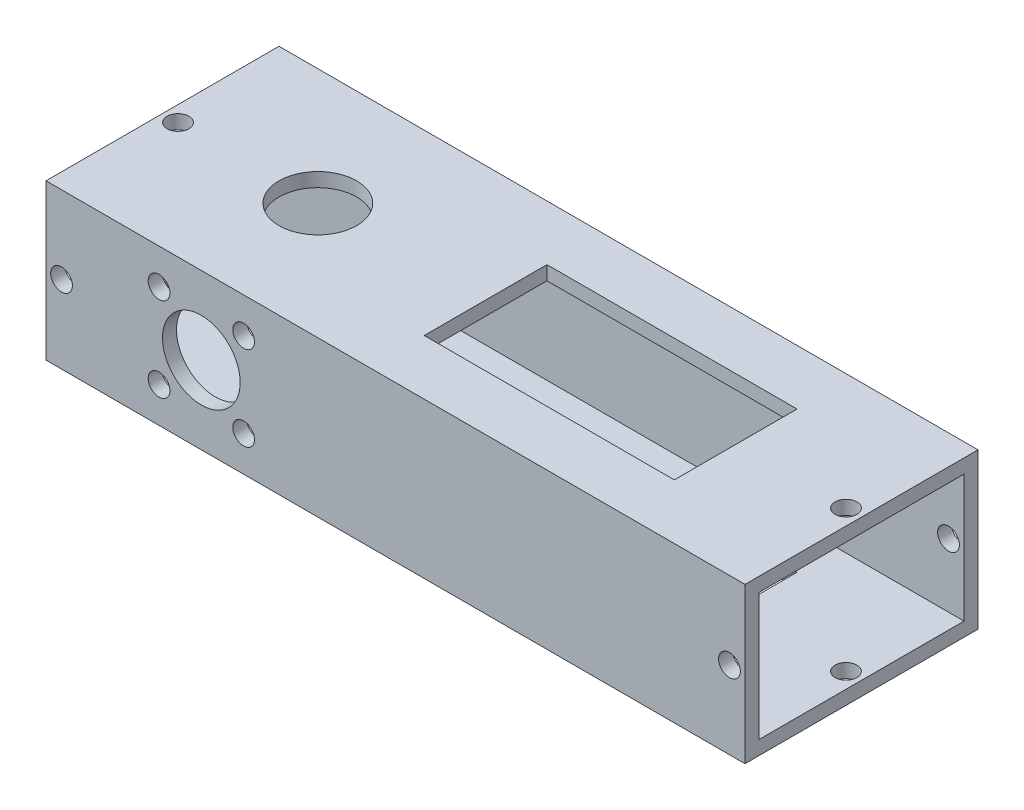
from build123d import *

# Parameters (mm, degrees)
SKETCH1_W           = 114.3
SKETCH1_H           = 38.1
BOSS_EXTRUDE1_DEPTH = 25.4
CUT_EXTRUDE1_REACH  = 125.131
SKETCH2_W           = 33.528
SKETCH2_H           = 20.828
CUT_EXTRUDE2_REACH  = 125.131
SKETCH3_R           = 1.778
CUT_EXTRUDE3_REACH  = 125.131
SKETCH4_R           = 1.778
CUT_EXTRUDE4_REACH  = 125.131
SKETCH5_R           = 1.778
SKETCH5_R_2         = 6.35
CUT_EXTRUDE5_REACH  = 125.131
SKETCH6_R           = 1.778
SKETCH6_R_2         = 6.35
CUT_EXTRUDE6_REACH  = 125.131
SKETCH7_R           = 1.778
SKETCH7_R_2         = 6.35
CUT_EXTRUDE7_REACH  = 125.131
SKETCH8_R           = 1.778
SKETCH8_R_2         = 6.35
CUT_EXTRUDE8_REACH  = 125.131
SKETCH9_R           = 1.778
CUT_EXTRUDE9_REACH  = 125.131
SKETCH10_R          = 1.778


with BuildPart() as part:
    # Sketch1 → Boss-Extrude1 (new body)
    with BuildSketch(Plane(origin=(0, 0, 0), x_dir=(1, 0, 0), z_dir=(0, 1, 0))):
        with Locations((-57.15, -19.05)):
            Rectangle(SKETCH1_W, SKETCH1_H)
    extrude(amount=BOSS_EXTRUDE1_DEPTH)

    # Sketch2 → Cut-Extrude1 (cut, up to next)
    with BuildSketch(Plane(origin=(0, 0, 0), x_dir=(0, 0, -1), z_dir=(1, 0, 0)), mode=Mode.PRIVATE) as cut_extrude1_sk1:
        with Locations((-19.05, 12.7)):
            Rectangle(SKETCH2_W, SKETCH2_H)
    cut_extrude1_tool1 = extrude(cut_extrude1_sk1.sketch, amount=-CUT_EXTRUDE1_REACH, mode=Mode.PRIVATE) & part.part
    add(cut_extrude1_tool1.solids().sort_by_distance((0, 12.7, 19.05))[0], mode=Mode.SUBTRACT)

    # Sketch3 → Cut-Extrude2 (cut, up to next)
    with BuildSketch(Plane.XY.offset(38.1), mode=Mode.PRIVATE) as cut_extrude2_sk1:
        with Locations((-2.54, 12.7)):
            Circle(SKETCH3_R)
    cut_extrude2_tool1 = extrude(cut_extrude2_sk1.sketch, amount=-CUT_EXTRUDE2_REACH, mode=Mode.PRIVATE) & part.part
    add(cut_extrude2_tool1.solids().sort_by_distance((-2.54, 12.7, 38.1))[0], mode=Mode.SUBTRACT)

    # Sketch4 → Cut-Extrude3 (cut, up to next)
    with BuildSketch(Plane(origin=(0, 0, 0), x_dir=(-1, 0, 0), z_dir=(0, 0, -1)), mode=Mode.PRIVATE) as cut_extrude3_sk1:
        with Locations(Location((2.54, 12.7, 0), (0, 0, 180))):
            Circle(SKETCH4_R)
    cut_extrude3_tool1 = extrude(cut_extrude3_sk1.sketch, amount=-CUT_EXTRUDE3_REACH, mode=Mode.PRIVATE) & part.part
    add(cut_extrude3_tool1.solids().sort_by_distance((-2.54, 12.7, 0))[0], mode=Mode.SUBTRACT)

    # Sketch5 → Cut-Extrude4 (cut, up to next)
    with BuildSketch(Plane.XY.offset(38.1), mode=Mode.PRIVATE) as cut_extrude4_sk1:
        with Locations((-111.76, 12.7)):
            Circle(SKETCH5_R)
    cut_extrude4_tool1 = extrude(cut_extrude4_sk1.sketch, amount=-CUT_EXTRUDE4_REACH, mode=Mode.PRIVATE) & part.part
    # Sketch5 → Cut-Extrude4 (cut, up to next)
    with BuildSketch(Plane.XY.offset(38.1), mode=Mode.PRIVATE) as cut_extrude4_sk2:
        with Locations((-88.9, 12.7)):
            Circle(SKETCH5_R_2)
    cut_extrude4_tool2 = extrude(cut_extrude4_sk2.sketch, amount=-CUT_EXTRUDE4_REACH, mode=Mode.PRIVATE) & part.part
    # Sketch5 → Cut-Extrude4 (cut, up to next)
    with BuildSketch(Plane.XY.offset(38.1), mode=Mode.PRIVATE) as cut_extrude4_sk3:
        with Locations((-95.814797213, 19.614797213)):
            Circle(SKETCH5_R)
    cut_extrude4_tool3 = extrude(cut_extrude4_sk3.sketch, amount=-CUT_EXTRUDE4_REACH, mode=Mode.PRIVATE) & part.part
    # Sketch5 → Cut-Extrude4 (cut, up to next)
    with BuildSketch(Plane.XY.offset(38.1), mode=Mode.PRIVATE) as cut_extrude4_sk4:
        with Locations((-81.985202787, 19.614797213)):
            Circle(SKETCH5_R)
    cut_extrude4_tool4 = extrude(cut_extrude4_sk4.sketch, amount=-CUT_EXTRUDE4_REACH, mode=Mode.PRIVATE) & part.part
    # Sketch5 → Cut-Extrude4 (cut, up to next)
    with BuildSketch(Plane.XY.offset(38.1), mode=Mode.PRIVATE) as cut_extrude4_sk5:
        with Locations((-95.814797213, 5.785202787)):
            Circle(SKETCH5_R)
    cut_extrude4_tool5 = extrude(cut_extrude4_sk5.sketch, amount=-CUT_EXTRUDE4_REACH, mode=Mode.PRIVATE) & part.part
    # Sketch5 → Cut-Extrude4 (cut, up to next)
    with BuildSketch(Plane.XY.offset(38.1), mode=Mode.PRIVATE) as cut_extrude4_sk6:
        with Locations((-81.985202787, 5.785202787)):
            Circle(SKETCH5_R)
    cut_extrude4_tool6 = extrude(cut_extrude4_sk6.sketch, amount=-CUT_EXTRUDE4_REACH, mode=Mode.PRIVATE) & part.part
    add(cut_extrude4_tool1.solids().sort_by_distance((-111.76, 12.7, 38.1))[0], mode=Mode.SUBTRACT)
    add(cut_extrude4_tool2.solids().sort_by_distance((-88.9, 12.7, 38.1))[0], mode=Mode.SUBTRACT)
    add(cut_extrude4_tool3.solids().sort_by_distance((-95.814797, 19.614797, 38.1))[0], mode=Mode.SUBTRACT)
    add(cut_extrude4_tool4.solids().sort_by_distance((-81.985203, 19.614797, 38.1))[0], mode=Mode.SUBTRACT)
    add(cut_extrude4_tool5.solids().sort_by_distance((-95.814797, 5.785203, 38.1))[0], mode=Mode.SUBTRACT)
    add(cut_extrude4_tool6.solids().sort_by_distance((-81.985203, 5.785203, 38.1))[0], mode=Mode.SUBTRACT)

    # Sketch6 → Cut-Extrude5 (cut, up to next)
    with BuildSketch(Plane(origin=(0, 0, 0), x_dir=(-1, 0, 0), z_dir=(0, 0, -1)), mode=Mode.PRIVATE) as cut_extrude5_sk1:
        with Locations(Location((111.76, 12.7, 0), (0, 0, 180))):
            Circle(SKETCH6_R)
    cut_extrude5_tool1 = extrude(cut_extrude5_sk1.sketch, amount=-CUT_EXTRUDE5_REACH, mode=Mode.PRIVATE) & part.part
    # Sketch6 → Cut-Extrude5 (cut, up to next)
    with BuildSketch(Plane(origin=(0, 0, 0), x_dir=(-1, 0, 0), z_dir=(0, 0, -1)), mode=Mode.PRIVATE) as cut_extrude5_sk2:
        with Locations(Location((88.9, 12.7, 0), (0, 0, 180))):
            Circle(SKETCH6_R_2)
    cut_extrude5_tool2 = extrude(cut_extrude5_sk2.sketch, amount=-CUT_EXTRUDE5_REACH, mode=Mode.PRIVATE) & part.part
    # Sketch6 → Cut-Extrude5 (cut, up to next)
    with BuildSketch(Plane(origin=(0, 0, 0), x_dir=(-1, 0, 0), z_dir=(0, 0, -1)), mode=Mode.PRIVATE) as cut_extrude5_sk3:
        with Locations(Location((81.985202787, 19.614797213, 0), (0, 0, 180))):
            Circle(SKETCH6_R)
    cut_extrude5_tool3 = extrude(cut_extrude5_sk3.sketch, amount=-CUT_EXTRUDE5_REACH, mode=Mode.PRIVATE) & part.part
    # Sketch6 → Cut-Extrude5 (cut, up to next)
    with BuildSketch(Plane(origin=(0, 0, 0), x_dir=(-1, 0, 0), z_dir=(0, 0, -1)), mode=Mode.PRIVATE) as cut_extrude5_sk4:
        with Locations(Location((95.814797213, 19.614797213, 0), (0, 0, 180))):
            Circle(SKETCH6_R)
    cut_extrude5_tool4 = extrude(cut_extrude5_sk4.sketch, amount=-CUT_EXTRUDE5_REACH, mode=Mode.PRIVATE) & part.part
    # Sketch6 → Cut-Extrude5 (cut, up to next)
    with BuildSketch(Plane(origin=(0, 0, 0), x_dir=(-1, 0, 0), z_dir=(0, 0, -1)), mode=Mode.PRIVATE) as cut_extrude5_sk5:
        with Locations(Location((95.814797213, 5.785202787, 0), (0, 0, 180))):
            Circle(SKETCH6_R)
    cut_extrude5_tool5 = extrude(cut_extrude5_sk5.sketch, amount=-CUT_EXTRUDE5_REACH, mode=Mode.PRIVATE) & part.part
    # Sketch6 → Cut-Extrude5 (cut, up to next)
    with BuildSketch(Plane(origin=(0, 0, 0), x_dir=(-1, 0, 0), z_dir=(0, 0, -1)), mode=Mode.PRIVATE) as cut_extrude5_sk6:
        with Locations(Location((81.985202787, 5.785202787, 0), (0, 0, 180))):
            Circle(SKETCH6_R)
    cut_extrude5_tool6 = extrude(cut_extrude5_sk6.sketch, amount=-CUT_EXTRUDE5_REACH, mode=Mode.PRIVATE) & part.part
    add(cut_extrude5_tool1.solids().sort_by_distance((-111.76, 12.7, 0))[0], mode=Mode.SUBTRACT)
    add(cut_extrude5_tool2.solids().sort_by_distance((-88.9, 12.7, 0))[0], mode=Mode.SUBTRACT)
    add(cut_extrude5_tool3.solids().sort_by_distance((-81.985203, 19.614797, 0))[0], mode=Mode.SUBTRACT)
    add(cut_extrude5_tool4.solids().sort_by_distance((-95.814797, 19.614797, 0))[0], mode=Mode.SUBTRACT)
    add(cut_extrude5_tool5.solids().sort_by_distance((-95.814797, 5.785203, 0))[0], mode=Mode.SUBTRACT)
    add(cut_extrude5_tool6.solids().sort_by_distance((-81.985203, 5.785203, 0))[0], mode=Mode.SUBTRACT)

    # Sketch7 → Cut-Extrude6 (cut, up to next)
    with BuildSketch(Plane(origin=(0, 25.4, 0), x_dir=(1, 0, 0), z_dir=(0, 1, 0)), mode=Mode.PRIVATE) as cut_extrude6_sk1:
        with Locations(Location((-111.76, -19.05, 0), (0, 0, 270))):
            Circle(SKETCH7_R)
    cut_extrude6_tool1 = extrude(cut_extrude6_sk1.sketch, amount=-CUT_EXTRUDE6_REACH, mode=Mode.PRIVATE) & part.part
    # Sketch7 → Cut-Extrude6 (cut, up to next)
    with BuildSketch(Plane(origin=(0, 25.4, 0), x_dir=(1, 0, 0), z_dir=(0, 1, 0)), mode=Mode.PRIVATE) as cut_extrude6_sk2:
        with Locations(Location((-88.9, -19.05, 0), (0, 0, 270))):
            Circle(SKETCH7_R_2)
    cut_extrude6_tool2 = extrude(cut_extrude6_sk2.sketch, amount=-CUT_EXTRUDE6_REACH, mode=Mode.PRIVATE) & part.part
    # Sketch7 → Cut-Extrude6 (cut, up to next)
    with BuildSketch(Plane(origin=(0, 25.4, 0), x_dir=(1, 0, 0), z_dir=(0, 1, 0)), mode=Mode.PRIVATE) as cut_extrude6_sk3:
        Polygon((-61.468, -19.05), (-61.468, -9.017), (-20.574, -9.017), (-20.574, -29.083), (-61.468, -29.083), align=None)
    cut_extrude6_tool3 = extrude(cut_extrude6_sk3.sketch, amount=-CUT_EXTRUDE6_REACH, mode=Mode.PRIVATE) & part.part
    add(cut_extrude6_tool1.solids().sort_by_distance((-111.76, 25.4, 19.05))[0], mode=Mode.SUBTRACT)
    add(cut_extrude6_tool2.solids().sort_by_distance((-88.9, 25.4, 19.05))[0], mode=Mode.SUBTRACT)
    add(cut_extrude6_tool3.solids().sort_by_distance((-41.021, 25.4, 19.05))[0], mode=Mode.SUBTRACT)

    # Sketch8 → Cut-Extrude7 (cut, up to next)
    with BuildSketch(Plane.XZ, mode=Mode.PRIVATE) as cut_extrude7_sk1:
        with Locations(Location((-111.76, 19.05, 0), (0, 0, 90))):
            Circle(SKETCH8_R)
    cut_extrude7_tool1 = extrude(cut_extrude7_sk1.sketch, amount=-CUT_EXTRUDE7_REACH, mode=Mode.PRIVATE) & part.part
    # Sketch8 → Cut-Extrude7 (cut, up to next)
    with BuildSketch(Plane.XZ, mode=Mode.PRIVATE) as cut_extrude7_sk2:
        with Locations(Location((-88.9, 19.05, 0), (0, 0, 90))):
            Circle(SKETCH8_R_2)
    cut_extrude7_tool2 = extrude(cut_extrude7_sk2.sketch, amount=-CUT_EXTRUDE7_REACH, mode=Mode.PRIVATE) & part.part
    # Sketch8 → Cut-Extrude7 (cut, up to next)
    with BuildSketch(Plane.XZ, mode=Mode.PRIVATE) as cut_extrude7_sk3:
        Polygon((-61.468, 19.05), (-61.468, 29.083), (-20.574, 29.083), (-20.574, 9.017), (-61.468, 9.017), align=None)
    cut_extrude7_tool3 = extrude(cut_extrude7_sk3.sketch, amount=-CUT_EXTRUDE7_REACH, mode=Mode.PRIVATE) & part.part
    add(cut_extrude7_tool1.solids().sort_by_distance((-111.76, 0, 19.05))[0], mode=Mode.SUBTRACT)
    add(cut_extrude7_tool2.solids().sort_by_distance((-88.9, 0, 19.05))[0], mode=Mode.SUBTRACT)
    add(cut_extrude7_tool3.solids().sort_by_distance((-41.021, 0, 19.05))[0], mode=Mode.SUBTRACT)

    # Sketch9 → Cut-Extrude8 (cut, up to next)
    with BuildSketch(Plane(origin=(0, 25.4, 0), x_dir=(1, 0, 0), z_dir=(0, 1, 0)), mode=Mode.PRIVATE) as cut_extrude8_sk1:
        with Locations(Location((-2.54, -19.05, 0), (0, 0, 270))):
            Circle(SKETCH9_R)
    cut_extrude8_tool1 = extrude(cut_extrude8_sk1.sketch, amount=-CUT_EXTRUDE8_REACH, mode=Mode.PRIVATE) & part.part
    add(cut_extrude8_tool1.solids().sort_by_distance((-2.54, 25.4, 19.05))[0], mode=Mode.SUBTRACT)

    # Sketch10 → Cut-Extrude9 (cut, up to next)
    with BuildSketch(Plane(origin=(0, 0, 0), x_dir=(-1, 0, 0), z_dir=(0, -1, 0)), mode=Mode.PRIVATE) as cut_extrude9_sk1:
        with Locations(Location((2.54, -19.05, 0), (0, 0, 270))):
            Circle(SKETCH10_R)
    cut_extrude9_tool1 = extrude(cut_extrude9_sk1.sketch, amount=-CUT_EXTRUDE9_REACH, mode=Mode.PRIVATE) & part.part
    add(cut_extrude9_tool1.solids().sort_by_distance((-2.54, 0, 19.05))[0], mode=Mode.SUBTRACT)


solid = part.part
